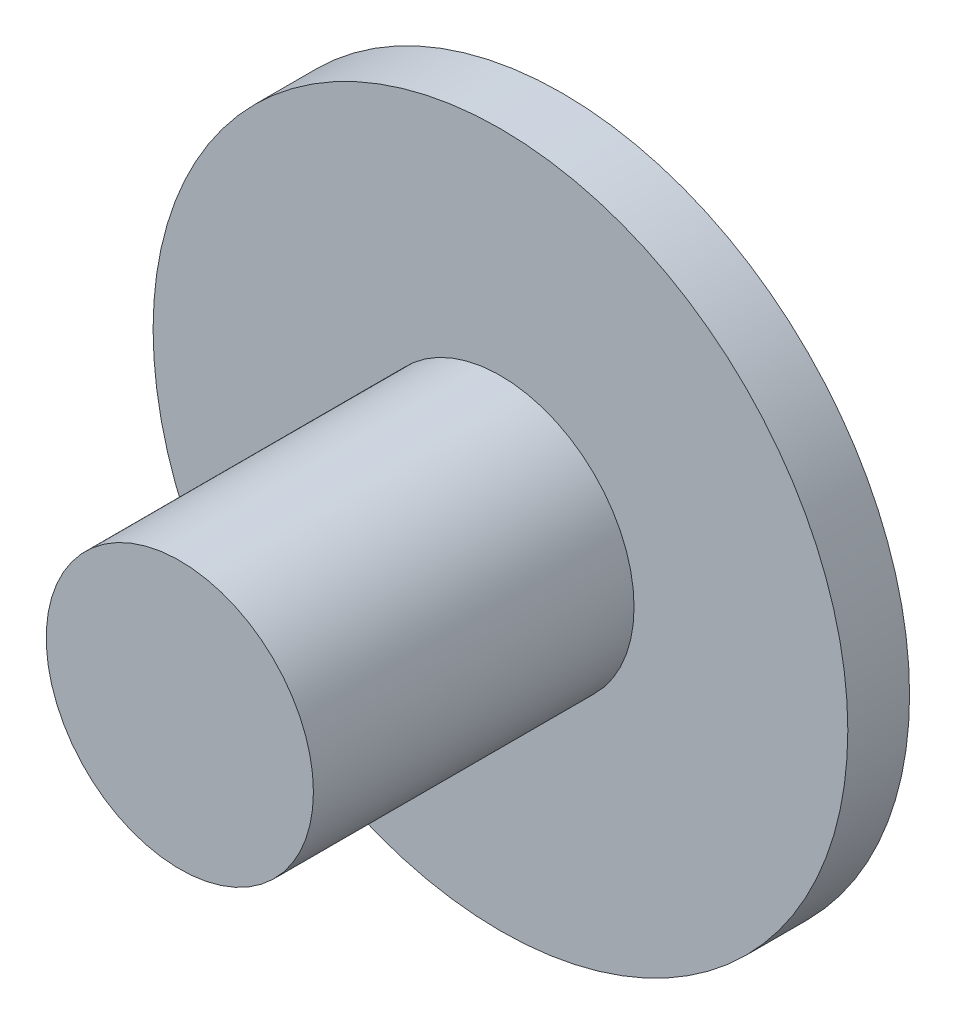
from build123d import *

# Parameters (mm, degrees)
SKETCH1_R           = 5
BOSS_EXTRUDE1_DEPTH = 80
SCALE1_SCALE        = 1.9329
BOSS_EXTRUDE2_START = 0.6
SKETCH3_R           = 25.1277
BOSS_EXTRUDE2_DEPTH = 0.6
SCALE2_SCALE        = 1.5


with BuildPart() as part:
    # Sketch1 → Boss-Extrude1 (new body)
    with BuildSketch(Plane.XY):
        Circle(SKETCH1_R)
    extrude(amount=BOSS_EXTRUDE1_DEPTH)

    # Sketch2 → Revolve1 (revolve)
    with BuildSketch(Plane(origin=(0, 0, 0), x_dir=(1, 0, 0), z_dir=(0, 1, 0))):
        Polygon((0, -66), (0, -68), (-5, -68), (-13, -68), (-13, -66), align=None)
    revolve(axis=Axis((0, 0, 66), (0, 0, 1)))


with BuildPart() as part_1:
    # Scale1: scaled about (0, 0, 43.398601399)
    add(part.part.scale(SCALE1_SCALE).moved(Location((0, 0, -40.486555245))))

    # Sketch3 → Boss-Extrude2 (add)
    with BuildSketch(Plane(origin=(0, 0, 87.084844755), x_dir=(-1, 0, 0), z_dir=(0, 0, -1)).offset(BOSS_EXTRUDE2_START)):
        Circle(SKETCH3_R)
    extrude(amount=-BOSS_EXTRUDE2_DEPTH)

    # Sketch4 → Cut-Revolve1 (revolve, cut)
    with BuildSketch(Plane(origin=(0, 0, 0), x_dir=(0, 0, -1), z_dir=(1, 0, 0)), mode=Mode.PRIVATE) as cut_revolve1_sk:
        Polygon((-76.705174755, 26.6900619), (-76.705174755, 0), (46.736883237, 0), (46.736883237, 27.883866585), align=None)
    revolve(cut_revolve1_sk.sketch.rotate(Axis((0, 0, 76.705174755), (0, 0, -1)), 270), axis=Axis((0, 0, 76.705174755), (0, 0, -1)), mode=Mode.SUBTRACT)


with BuildPart() as part_2:
    # Scale2: scaled about (0, 0, 92.693679073)
    add(part_1.part.scale(SCALE2_SCALE).moved(Location((0, 0, -46.346839536))))


solid = part_2.part
